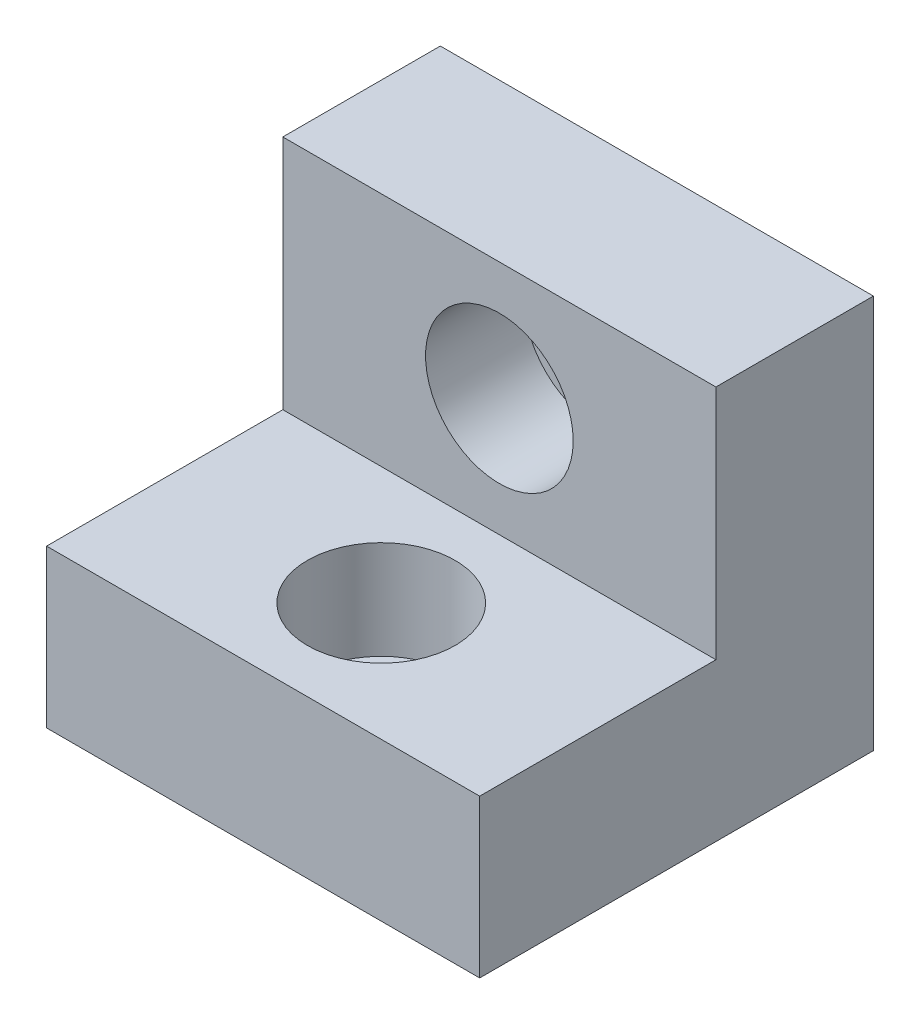
from build123d import *

# Parameters (mm, degrees)
BOSS_EXTRUDE1_DEPTH = 22
SKETCH2_R           = 3.75
CUT_EXTRUDE1_DEPTH  = 5
SKETCH3_R           = 2.4
CUT_EXTRUDE2_DEPTH  = 5
SKETCH4_R           = 3.75
CUT_EXTRUDE3_DEPTH  = 5
SKETCH5_R           = 2.4
CUT_EXTRUDE4_DEPTH  = 5


with BuildPart() as part:
    # Sketch1 → Boss-Extrude1 (new body)
    with BuildSketch(Plane(origin=(0, 0, 0), x_dir=(0, 0, -1), z_dir=(1, 0, 0))):
        Polygon((0, 0), (-12, 0), (-12, -8), (8, -8), (8, 12), (0, 12), align=None)
    extrude(amount=BOSS_EXTRUDE1_DEPTH)

    # Sketch2 → Cut-Extrude1 (cut)
    with BuildSketch(Plane.XY):
        with Locations((11, 6)):
            Circle(SKETCH2_R)
    extrude(amount=-CUT_EXTRUDE1_DEPTH, mode=Mode.SUBTRACT)

    # Sketch3 → Cut-Extrude2 (cut)
    with BuildSketch(Plane.XY.offset(-5)):
        with Locations((11, 6)):
            Circle(SKETCH3_R)
    extrude(amount=-CUT_EXTRUDE2_DEPTH, mode=Mode.SUBTRACT)

    # Sketch4 → Cut-Extrude3 (cut)
    with BuildSketch(Plane(origin=(0, 0, 0), x_dir=(1, 0, 0), z_dir=(0, 1, 0))):
        with Locations((11, -6)):
            Circle(SKETCH4_R)
    extrude(amount=-CUT_EXTRUDE3_DEPTH, mode=Mode.SUBTRACT)

    # Sketch5 → Cut-Extrude4 (cut)
    with BuildSketch(Plane(origin=(0, -5, 0), x_dir=(1, 0, 0), z_dir=(0, 1, 0))):
        with Locations((11, -6)):
            Circle(SKETCH5_R)
    extrude(amount=-CUT_EXTRUDE4_DEPTH, mode=Mode.SUBTRACT)


solid = part.part
